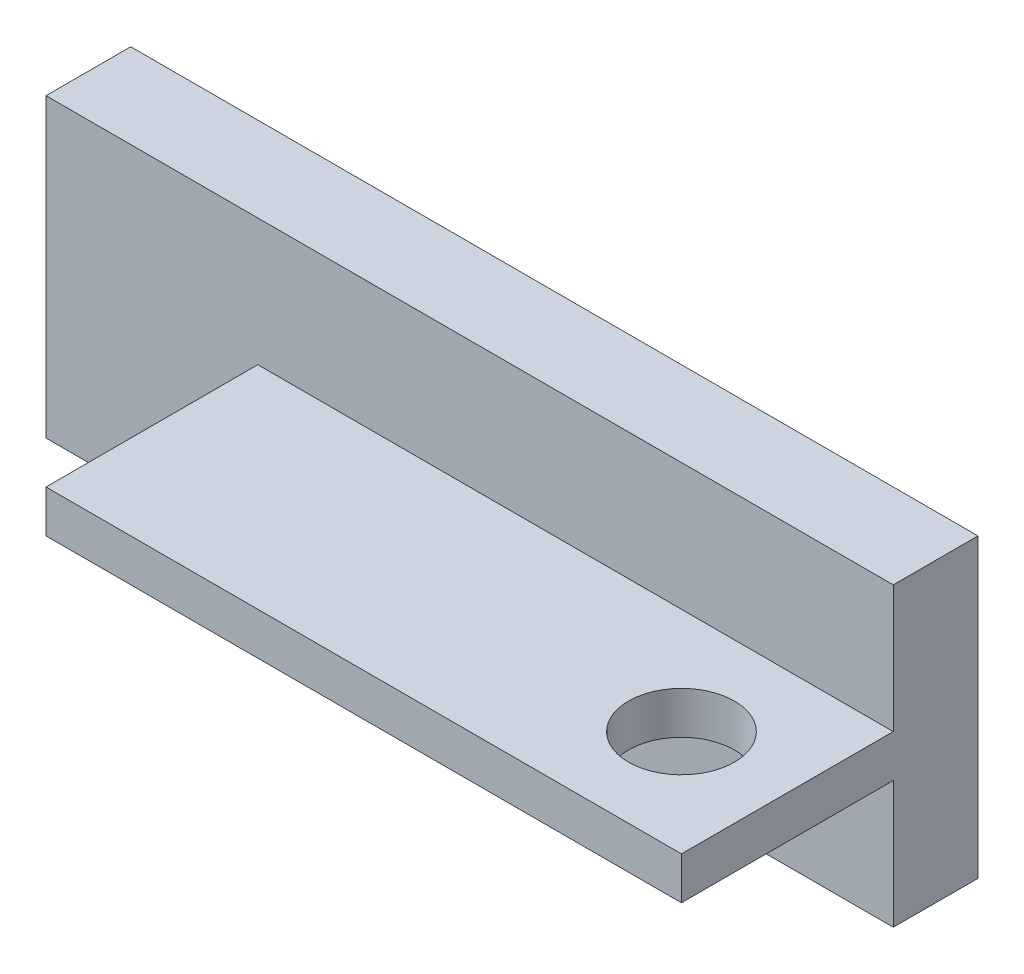
from build123d import *

# Parameters (mm, degrees)
SKETCH1_W           = 200
SKETCH1_H           = 70
BOSS_EXTRUDE1_DEPTH = 10
SKETCH2_W           = 200
SKETCH2_H           = 20
BOSS_EXTRUDE2_DEPTH = 30
SKETCH3_W           = 200
SKETCH3_H           = 20
BOSS_EXTRUDE3_DEPTH = 30
SKETCH4_R           = 12.5
CUT_EXTRUDE1_DEPTH  = 30
SKETCH5_W           = 50
SKETCH5_H           = 50
CUT_EXTRUDE2_DEPTH  = 30


with BuildPart() as part:
    # Sketch1 → Boss-Extrude1 (new body)
    with BuildSketch(Plane(origin=(0, 0, 0), x_dir=(1, 0, 0), z_dir=(0, 1, 0))):
        with Locations((-100, 35)):
            Rectangle(SKETCH1_W, SKETCH1_H)
    extrude(amount=BOSS_EXTRUDE1_DEPTH)

    # Sketch2 → Boss-Extrude2 (add)
    with BuildSketch(Plane(origin=(0, 10, 0), x_dir=(1, 0, 0), z_dir=(0, 1, 0))):
        with Locations((-100, 60)):
            Rectangle(SKETCH2_W, SKETCH2_H)
    extrude(amount=BOSS_EXTRUDE2_DEPTH)

    # Sketch3 → Boss-Extrude3 (add)
    with BuildSketch(Plane.XZ):
        with Locations((-100, -60)):
            Rectangle(SKETCH3_W, SKETCH3_H)
    extrude(amount=BOSS_EXTRUDE3_DEPTH)

    # Sketch4 → Cut-Extrude1 (cut)
    with BuildSketch(Plane(origin=(0, 10, 0), x_dir=(1, 0, 0), z_dir=(0, 1, 0))):
        with Locations(Location((-25, 25, 0), (0, 0, 270))):
            Circle(SKETCH4_R)
        with Locations(Location((-175, 25, 0), (0, 0, 270))):
            Circle(SKETCH4_R)
    extrude(amount=-CUT_EXTRUDE1_DEPTH, mode=Mode.SUBTRACT)

    # Sketch5 → Cut-Extrude2 (cut)
    with BuildSketch(Plane(origin=(0, 10, 0), x_dir=(1, 0, 0), z_dir=(0, 1, 0))):
        with Locations((-175, 25)):
            Rectangle(SKETCH5_W, SKETCH5_H)
    extrude(amount=-CUT_EXTRUDE2_DEPTH, mode=Mode.SUBTRACT)


solid = part.part
